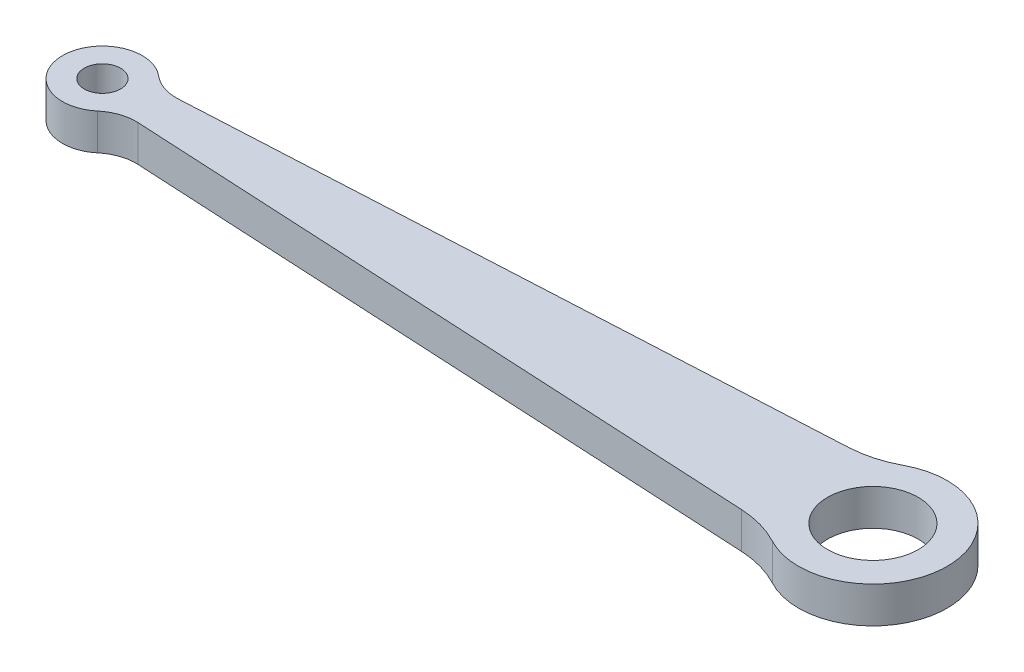
from build123d import *

# Parameters (mm, degrees)
SKETCH1_R           = 1.5875
SKETCH1_R_2         = 3.96875
BOSS_EXTRUDE1_DEPTH = 3.175


with BuildPart() as part:
    # Sketch1 → Boss-Extrude1 (new body)
    with BuildSketch(Plane(origin=(0, 0, 0), x_dir=(1, 0, 0), z_dir=(0, 1, 0))):
        with BuildLine():
            Line((4.906744273, 1.778), (60.663965564, 4.700112147))
            ThreePointArc((60.663965564, 4.700112147), (62.585298916, 5.014270589), (64.392175829, 5.739124507))
            ThreePointArc((64.392175829, 5.739124507), (73.97115, 0), (64.392175829, -5.739124507))
            ThreePointArc((64.392175829, -5.739124507), (62.585298916, -5.014270589), (60.663965564, -4.700112147))
            Line((60.663965564, -4.700112147), (4.906744273, -1.778))
            ThreePointArc((4.906744273, -1.778), (3.494086568, -1.971116067), (2.251338568, -2.670024513))
            ThreePointArc((2.251338568, -2.670024513), (-3.4925, 0), (2.251338568, 2.670024513))
            ThreePointArc((2.251338568, 2.670024513), (3.494086568, 1.971116067), (4.906744273, 1.778))
        make_face()
        with Locations(Location((0, 0, 0), (0, 0, 270))):
            Circle(SKETCH1_R, mode=Mode.SUBTRACT)
        with Locations(Location((67.4624, 0, 0), (0, 0, 270))):
            Circle(SKETCH1_R_2, mode=Mode.SUBTRACT)
    extrude(amount=BOSS_EXTRUDE1_DEPTH)


solid = part.part
